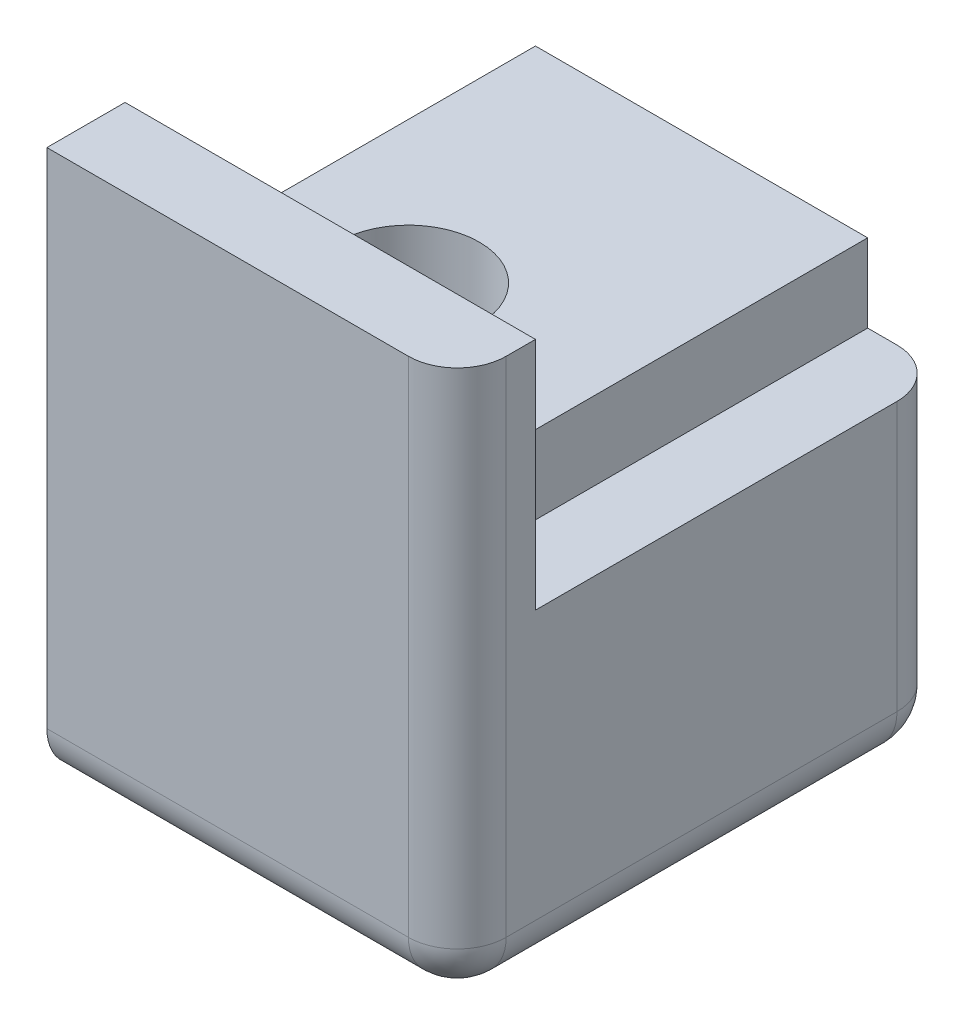
from build123d import *

# Parameters (mm, degrees)
SKETCH2_W               = 8.4
SKETCH2_H               = 10
BOSS_EXTRUDE1_DEPTH     = 11.3
SKETCH5_W               = 8.4
SKETCH5_H               = 1.5
CUT_EXTRUDE2_DEPTH      = 11.3
SKETCH7_W               = 1.6
SKETCH7_H               = 3.3
CUT_EXTRUDE4_DEPTH      = 8.4
SKETCH9_W               = 8.4
SKETCH9_H               = 1.7
CUT_EXTRUDE5_DEPTH      = 6.8
SKETCH12_W              = 6.8
SKETCH12_H              = 1.6
BOSS_EXTRUDE3_DEPTH     = 1.6
FILLET1_R               = 1
M3_5X0_6_TAPPED_HOLE1_D = 2.9
SKETCH20_W              = 1.6
SKETCH20_H              = 1.6
CUT_EXTRUDE6_DEPTH      = 6.8


with BuildPart() as part:
    # Sketch2 → Boss-Extrude1 (new body)
    with BuildSketch(Plane(origin=(0, 0, 0), x_dir=(1, 0, 0), z_dir=(0, 1, 0))):
        Rectangle(SKETCH2_W, SKETCH2_H)
    extrude(amount=BOSS_EXTRUDE1_DEPTH)

    # Sketch5 → Cut-Extrude2 (cut)
    with BuildSketch(Plane(origin=(4.2, 0, 0), x_dir=(0, 0, -1), z_dir=(1, 0, 0))):
        with Locations((0.8, 10.55)):
            Rectangle(SKETCH5_W, SKETCH5_H)
    extrude(amount=-CUT_EXTRUDE2_DEPTH, mode=Mode.SUBTRACT)

    # Sketch7 → Cut-Extrude4 (cut)
    with BuildSketch(Plane(origin=(0, 0, -5), x_dir=(-1, 0, 0), z_dir=(0, 0, -1))):
        with Locations((-3.4, 8.15)):
            Rectangle(SKETCH7_W, SKETCH7_H)
    extrude(amount=-CUT_EXTRUDE4_DEPTH, mode=Mode.SUBTRACT)

    # Sketch9 → Cut-Extrude5 (cut)
    with BuildSketch(Plane(origin=(2.6, 0, 0), x_dir=(0, 0, -1), z_dir=(1, 0, 0))):
        with Locations((0.8, 8.95)):
            Rectangle(SKETCH9_W, SKETCH9_H)
    extrude(amount=-CUT_EXTRUDE5_DEPTH, mode=Mode.SUBTRACT)

    # Sketch12 → Boss-Extrude3 (add)
    with BuildSketch(Plane(origin=(0, 0, 3.4), x_dir=(-1, 0, 0), z_dir=(0, 0, -1))):
        with Locations((0.8, 8.9)):
            Rectangle(SKETCH12_W, SKETCH12_H)
    extrude(amount=BOSS_EXTRUDE3_DEPTH)

    # Fillet1
    fillet1_edges = [part.edges().sort_by_distance(p)[0] for p in [
        (4.2, 3.25, -5),
        (0, 0, 5),
        (0, 0, -5),
        (4.2, 0, 0),
        (4.2, 5.65, 5),
    ]]
    fillet(fillet1_edges, radius=FILLET1_R)

    # M3.5x0.6 Tapped Hole1 (through all)
    with Locations(Plane(origin=(0, 0, 0), x_dir=(-1, 0, 0), z_dir=(0, -1, 0))):
        with Locations((1.3, -0.5)):
            Hole(M3_5X0_6_TAPPED_HOLE1_D / 2)

    # Sketch20 → Cut-Extrude6 (cut)
    with BuildSketch(Plane(origin=(2.6, 0, 0), x_dir=(0, 0, -1), z_dir=(1, 0, 0))):
        with Locations((-2.6, 8.9)):
            Rectangle(SKETCH20_W, SKETCH20_H)
    extrude(amount=-CUT_EXTRUDE6_DEPTH, mode=Mode.SUBTRACT)


solid = part.part
